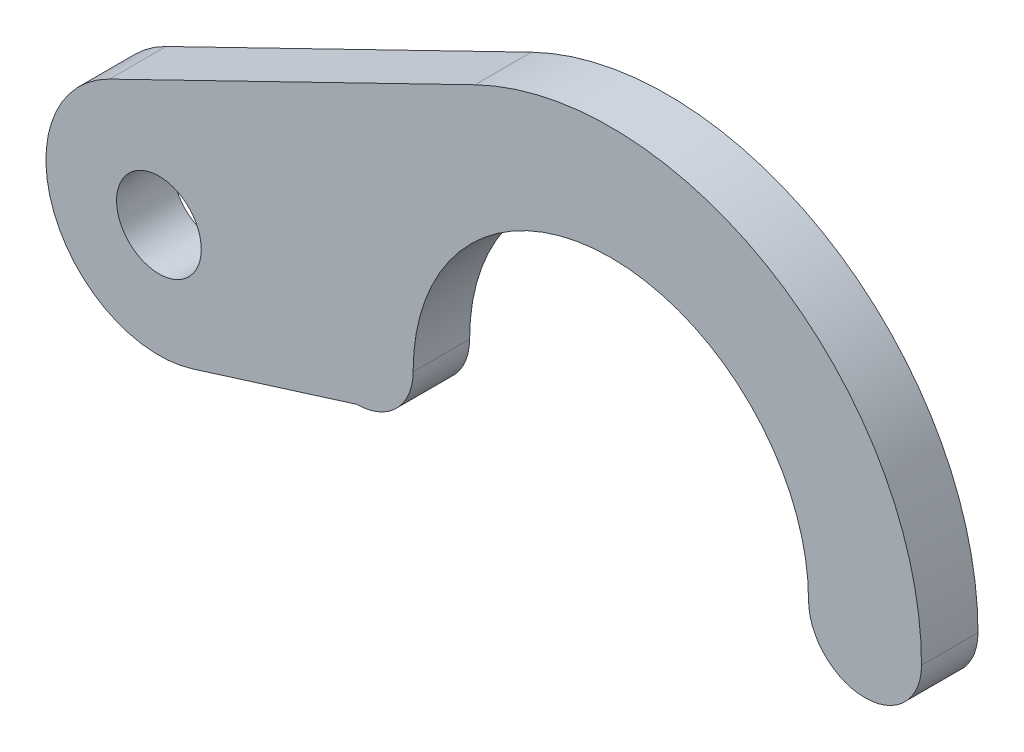
from build123d import *

# Parameters (mm, degrees)
SKETCH2_R           = 4.7625
BOSS_EXTRUDE1_DEPTH = 6.35


with BuildPart() as part:
    # Sketch2 → Boss-Extrude1 (new body)
    with BuildSketch(Plane.XY):
        with BuildLine():
            Line((-56.35625, 11.420073815), (-15.2796875, 31.405202991))
            ThreePointArc((-15.2796875, 31.405202991), (18.52177825, 29.609109333), (34.925, 0))
            ThreePointArc((34.925, 0), (28.575, -6.35), (22.225, 0))
            ThreePointArc((22.225, 0), (0, 22.225), (-22.225, 0))
            ThreePointArc((-22.225, 0), (-24.084871939, -4.490128061), (-28.575, -6.35))
            Line((-28.575, -6.35), (-47.005701288, -12.119954508))
            ThreePointArc((-47.005701288, -12.119954508), (-62.602938255, -4.688352434), (-56.35625, 11.420073815))
        make_face()
        with Locations((-50.8, 0)):
            Circle(SKETCH2_R, mode=Mode.SUBTRACT)
    extrude(amount=BOSS_EXTRUDE1_DEPTH)


solid = part.part
